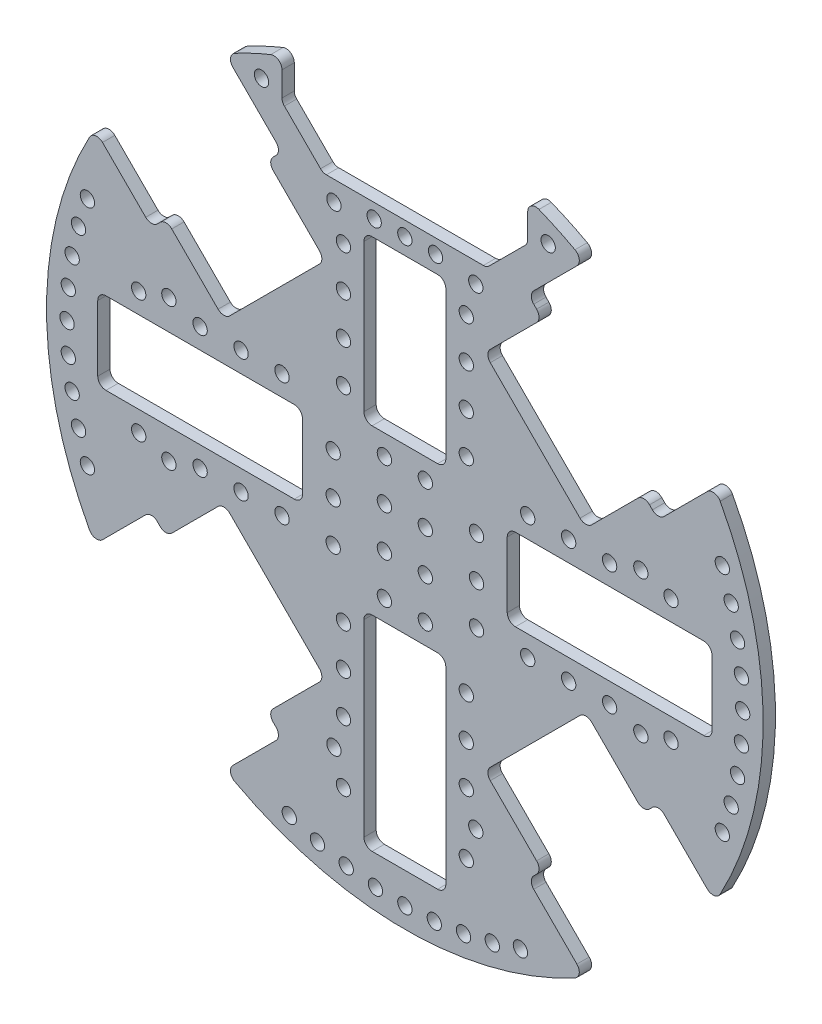
from build123d import *

# Parameters (mm, degrees)
SKETCH1_R                                  = 87.5
BOSS_EXTRUDE1_DEPTH                        = 3
CUT_EXTRUDE3_START                         = -124.780046857
CUT_EXTRUDE3_DEPTH                         = 125.780046857
SKETCH5_R                                  = 1.75
CUT_EXTRUDE4_DEPTH                         = 124.780046857
MIRROR3_START                              = -124.780046857
MIRROR3_AT_THE_SECOND_PLANE_COPY_1_DEPTH   = 125.780046857
MIRROR3_AT_THE_SECOND_PLANE_COPY_2_SKETC_R = 1.75
MIRROR3_AT_THE_SECOND_PLANE_COPY_2_DEPTH   = 124.780046857
CUT_EXTRUDE5_DEPTH                         = 124.780046857
SKETCH7_W                                  = 50
SKETCH7_H                                  = 20
SKETCH7_W_2                                = 20
SKETCH7_H_2                                = 50
SKETCH7_H_3                                = 40
CUT_EXTRUDE6_DEPTH                         = 124.780046857
FILLET1_R                                  = 2
SKETCH8_R                                  = 1.75
CUT_EXTRUDE7_DEPTH                         = 124.780046857
CIRPATTERN1_COUNT                          = 5
CIRPATTERN1_ANGLE                          = 20
CIRPATTERN1_THE_OTHER_WAY_COUNT            = 5
CIRPATTERN1_THE_OTHER_WAY_ANGLE            = 20
CIRPATTERN2_COUNT                          = 3
CIRPATTERN2_ANGLE                          = 180
CIRPATTERN2_COPY_1_SKETCH_R                = 1.75
CIRPATTERN2_COPY_1_DEPTH                   = 124.780046857
CIRPATTERN2_COPY_2_SKETCH_R                = 1.75
CIRPATTERN2_COPY_2_DEPTH                   = 124.780046857
CIRPATTERN2_COPY_3_SKETCH_R                = 1.75
CIRPATTERN2_COPY_3_DEPTH                   = 124.780046857
CIRPATTERN2_COPY_4_SKETCH_R                = 1.75
CIRPATTERN2_COPY_4_DEPTH                   = 124.780046857
CIRPATTERN2_COPY_5_SKETCH_R                = 1.75
CIRPATTERN2_COPY_5_DEPTH                   = 124.780046857
CIRPATTERN2_COPY_6_SKETCH_R                = 1.75
CIRPATTERN2_COPY_6_DEPTH                   = 124.780046857
CIRPATTERN2_COPY_7_SKETCH_R                = 1.75
CIRPATTERN2_COPY_7_DEPTH                   = 124.780046857
CIRPATTERN2_COPY_8_SKETCH_R                = 1.75
CIRPATTERN2_COPY_8_DEPTH                   = 124.780046857
CIRPATTERN2_COPY_9_SKETCH_R                = 1.75
CIRPATTERN2_COPY_9_DEPTH                   = 124.780046857
CIRPATTERN2_COPY_10_SKETCH_R               = 1.75
CIRPATTERN2_COPY_10_DEPTH                  = 124.780046857
CIRPATTERN2_COPY_11_SKETCH_R               = 1.75
CIRPATTERN2_COPY_11_DEPTH                  = 124.780046857
CIRPATTERN2_COPY_12_SKETCH_R               = 1.75
CIRPATTERN2_COPY_12_DEPTH                  = 124.780046857
CIRPATTERN2_COPY_13_SKETCH_R               = 1.75
CIRPATTERN2_COPY_13_DEPTH                  = 124.780046857
CIRPATTERN2_COPY_14_SKETCH_R               = 1.75
CIRPATTERN2_COPY_14_DEPTH                  = 124.780046857
CIRPATTERN2_COPY_15_SKETCH_R               = 1.75
CIRPATTERN2_COPY_15_DEPTH                  = 124.780046857
CIRPATTERN2_COPY_16_SKETCH_R               = 1.75
CIRPATTERN2_COPY_16_DEPTH                  = 124.780046857
SKETCH9_R                                  = 1.75
CUT_EXTRUDE8_DEPTH                         = 124.780046857
CIRPATTERN3_COUNT                          = 2
CIRPATTERN3_ANGLE                          = 90
SKETCH10_R                                 = 1.75
CUT_EXTRUDE9_DEPTH                         = 124.780046857
SKETCH11_R                                 = 1.75
CUT_EXTRUDE10_DEPTH                        = 124.780046857
SKETCH12_R                                 = 1.75
CUT_EXTRUDE11_DEPTH                        = 124.780046857
SKETCH13_R                                 = 1.75
CUT_EXTRUDE12_DEPTH                        = 124.780046857


with BuildPart() as part:
    # Sketch1 → Boss-Extrude1 (new body)
    with BuildSketch(Plane.XY):
        Circle(SKETCH1_R)
    extrude(amount=BOSS_EXTRUDE1_DEPTH)

    # Sketch4 → Cut-Extrude3 (cut)
    with BuildSketch(Plane.XY.offset(3).offset(CUT_EXTRUDE3_START)):
        Polygon((30.0520382, 61.871843354), (33.587572106, 58.336309448), (19.445436483, 44.194173824), (44.194173824, 19.445436483), (58.336309448, 33.587572106), (61.871843354, 30.0520382), (84.806371442, 52.986566289), (52.986566289, 84.806371442), align=None)
    cut_extrude3 = extrude(amount=CUT_EXTRUDE3_DEPTH, mode=Mode.SUBTRACT)

    # Sketch5 → Cut-Extrude4 (cut, through all)
    with BuildSketch(Plane(origin=(0, 0, 0), x_dir=(-1, 0, 0), z_dir=(0, 0, -1))):
        with Locations((-17.324116139, 57.629202667)):
            Circle(SKETCH5_R)
        with Locations((-57.629202667, 17.324116139)):
            Circle(SKETCH5_R)
    cut_extrude4 = extrude(amount=-CUT_EXTRUDE4_DEPTH, mode=Mode.SUBTRACT)

    # Mirror3: Cut-Extrude3, Cut-Extrude4 across plane
    add(cut_extrude3.mirror(Plane(origin=(0, 0, 0), x_dir=(0, 0, 1), z_dir=(1, 0, 0))), mode=Mode.SUBTRACT)
    add(cut_extrude4.mirror(Plane(origin=(0, 0, 0), x_dir=(0, 0, 1), z_dir=(1, 0, 0))), mode=Mode.SUBTRACT)

    # Mirror3 at the second plane: Cut-Extrude3, Cut-Extrude4 across plane
    add(cut_extrude3.mirror(Plane.ZX), mode=Mode.SUBTRACT)
    add(cut_extrude4.mirror(Plane.ZX), mode=Mode.SUBTRACT)

    # Mirror3 at the second plane copy 1 sketc → Mirror3 at the second plane copy 1 (cut)
    with BuildSketch(Plane(origin=(0, 0, 3), x_dir=(-1, 0, 0), z_dir=(0, 0, 1)).offset(MIRROR3_START)):
        Polygon((30.0520382, 61.871843354), (33.587572106, 58.336309448), (19.445436483, 44.194173824), (44.194173824, 19.445436483), (58.336309448, 33.587572106), (61.871843354, 30.0520382), (84.806371442, 52.986566289), (52.986566289, 84.806371442), align=None)
    extrude(amount=MIRROR3_AT_THE_SECOND_PLANE_COPY_1_DEPTH, mode=Mode.SUBTRACT)

    # Mirror3 at the second plane copy 2 sketc → Mirror3 at the second plane copy 2 (cut, through all)
    with BuildSketch(Plane(origin=(0, 0, 0), x_dir=(1, 0, 0), z_dir=(0, 0, -1))):
        with Locations((-17.324116139, 57.629202667)):
            Circle(MIRROR3_AT_THE_SECOND_PLANE_COPY_2_SKETC_R)
        with Locations((-57.629202667, 17.324116139)):
            Circle(MIRROR3_AT_THE_SECOND_PLANE_COPY_2_SKETC_R)
    extrude(amount=-MIRROR3_AT_THE_SECOND_PLANE_COPY_2_DEPTH, mode=Mode.SUBTRACT)

    # Sketch6 → Cut-Extrude5 (cut, through all)
    with BuildSketch(Plane(origin=(0, 0, 0), x_dir=(-1, 0, 0), z_dir=(0, 0, -1))):
        Polygon((-30, 72.5), (-20, 62.5), (20, 62.5), (30, 72.5), (30, 87.5), (-30, 87.5), align=None)
    extrude(amount=-CUT_EXTRUDE5_DEPTH, mode=Mode.SUBTRACT)

    # Sketch7 → Cut-Extrude6 (cut, through all)
    with BuildSketch(Plane(origin=(0, 0, 0), x_dir=(-1, 0, 0), z_dir=(0, 0, -1))):
        with Locations((-50, 0)):
            Rectangle(SKETCH7_W, SKETCH7_H)
        with Locations((50, 0)):
            Rectangle(SKETCH7_W, SKETCH7_H)
        with Locations((0, -50)):
            Rectangle(SKETCH7_W_2, SKETCH7_H_2)
        with Locations((0, 35)):
            Rectangle(SKETCH7_W_2, SKETCH7_H_3)
    extrude(amount=-CUT_EXTRUDE6_DEPTH, mode=Mode.SUBTRACT)

    # Fillet1
    fillet1_edges = [part.edges().sort_by_distance(p)[0] for p in [
        (-43.881401139, -75.701206292, 1.5),
        (-75.701206292, -43.881401139, 1.5),
        (-44.194173824, -19.445436483, 1.5),
        (-58.336309448, -33.587572106, 1.5),
        (-61.871843354, -30.0520382, 1.5),
        (-30.0520382, -61.871843354, 1.5),
        (-33.587572106, -58.336309448, 1.5),
        (-19.445436483, -44.194173824, 1.5),
        (61.871843354, 30.0520382, 1.5),
        (43.881401139, 75.701206292, 1.5),
        (44.194173824, 19.445436483, 1.5),
        (58.336309448, 33.587572106, 1.5),
        (75.701206292, 43.881401139, 1.5),
        (30.0520382, 61.871843354, 1.5),
        (33.587572106, 58.336309448, 1.5),
        (19.445436483, 44.194173824, 1.5),
        (-30, 82.196411114, 1.5),
        (30, 82.196411114, 1.5),
        (30, 72.5, 1.5),
        (-30, 72.5, 1.5),
        (-20, 62.5, 1.5),
        (20, 62.5, 1.5),
        (25, 10, 1.5),
        (25, -10, 1.5),
        (75, -10, 1.5),
        (75, 10, 1.5),
        (-25, -10, 1.5),
        (-25, 10, 1.5),
        (-75, 10, 1.5),
        (-75, -10, 1.5),
        (-10, -25, 1.5),
        (-10, -75, 1.5),
        (10, -75, 1.5),
        (10, -25, 1.5),
        (-10, 55, 1.5),
        (-10, 15, 1.5),
        (10, 15, 1.5),
        (10, 55, 1.5),
        (30.0520382, -61.871843354, 1.5),
        (75.701206292, -43.881401139, 1.5),
        (58.336309448, -33.587572106, 1.5),
        (44.194173824, -19.445436483, 1.5),
        (19.445436483, -44.194173824, 1.5),
        (33.587572106, -58.336309448, 1.5),
        (43.881401139, -75.701206292, 1.5),
        (61.871843354, -30.0520382, 1.5),
        (-30.0520382, 61.871843354, 1.5),
        (-75.701206292, 43.881401139, 1.5),
        (-58.336309448, 33.587572106, 1.5),
        (-44.194173824, 19.445436483, 1.5),
        (-19.445436483, 44.194173824, 1.5),
        (-33.587572106, 58.336309448, 1.5),
        (-43.881401139, 75.701206292, 1.5),
        (-61.871843354, 30.0520382, 1.5),
    ]]
    fillet(fillet1_edges, radius=FILLET1_R)

    # Sketch8 → Cut-Extrude7 (cut, through all)
    with BuildSketch(Plane(origin=(0, 0, 0), x_dir=(-1, 0, 0), z_dir=(0, 0, -1))):
        with Locations((-82.5, 0)):
            Circle(SKETCH8_R)
    cut_extrude7 = extrude(amount=-CUT_EXTRUDE7_DEPTH, mode=Mode.SUBTRACT)

    # CirPattern1: Cut-Extrude7 ×5 about axis
    cirpattern1_axis = Axis((0, 0, 0), (0, 0, 1))
    for i in range(1, CIRPATTERN1_COUNT):
        add(cut_extrude7.rotate(cirpattern1_axis, i * CIRPATTERN1_ANGLE / (CIRPATTERN1_COUNT - 1)), mode=Mode.SUBTRACT)

    # CirPattern1 the other way: Cut-Extrude7 ×5 about axis
    cirpattern1_the_other_way_axis = Axis((0, 0, 0), (0, 0, -1))
    for i in range(1, CIRPATTERN1_THE_OTHER_WAY_COUNT):
        add(cut_extrude7.rotate(cirpattern1_the_other_way_axis, i * CIRPATTERN1_THE_OTHER_WAY_ANGLE / (CIRPATTERN1_THE_OTHER_WAY_COUNT - 1)), mode=Mode.SUBTRACT)

    # CirPattern2: Cut-Extrude7 ×3 about axis
    cirpattern2_axis = Axis((0, 0, 0), (0, 0, -1))
    for i in range(1, CIRPATTERN2_COUNT):
        add(cut_extrude7.rotate(cirpattern2_axis, i * CIRPATTERN2_ANGLE / (CIRPATTERN2_COUNT - 1)), mode=Mode.SUBTRACT)

    # CirPattern2 copy 1 sketch → CirPattern2 copy 1 (cut, through all)
    with BuildSketch(Plane(origin=(0, 0, 0), x_dir=(-0.08715574274765489, 0.9961946980917459, 0), z_dir=(0, 0, -1))):
        with Locations((-82.5, 0)):
            Circle(CIRPATTERN2_COPY_1_SKETCH_R)
    extrude(amount=-CIRPATTERN2_COPY_1_DEPTH, mode=Mode.SUBTRACT)

    # CirPattern2 copy 2 sketch → CirPattern2 copy 2 (cut, through all)
    with BuildSketch(Plane(origin=(0, 0, 0), x_dir=(0.9961946980917461, 0.08715574274765142, 0), z_dir=(0, 0, -1))):
        with Locations((-82.5, 0)):
            Circle(CIRPATTERN2_COPY_2_SKETCH_R)
    extrude(amount=-CIRPATTERN2_COPY_2_DEPTH, mode=Mode.SUBTRACT)

    # CirPattern2 copy 3 sketch → CirPattern2 copy 3 (cut, through all)
    with BuildSketch(Plane(origin=(0, 0, 0), x_dir=(-0.1736481776669273, 0.9848077530122086, 0), z_dir=(0, 0, -1))):
        with Locations((-82.5, 0)):
            Circle(CIRPATTERN2_COPY_3_SKETCH_R)
    extrude(amount=-CIRPATTERN2_COPY_3_DEPTH, mode=Mode.SUBTRACT)

    # CirPattern2 copy 4 sketch → CirPattern2 copy 4 (cut, through all)
    with BuildSketch(Plane(origin=(0, 0, 0), x_dir=(0.9848077530122092, 0.17364817766692386, 0), z_dir=(0, 0, -1))):
        with Locations((-82.5, 0)):
            Circle(CIRPATTERN2_COPY_4_SKETCH_R)
    extrude(amount=-CIRPATTERN2_COPY_4_DEPTH, mode=Mode.SUBTRACT)

    # CirPattern2 copy 5 sketch → CirPattern2 copy 5 (cut, through all)
    with BuildSketch(Plane(origin=(0, 0, 0), x_dir=(-0.258819045102518, 0.965925826289069, 0), z_dir=(0, 0, -1))):
        with Locations((-82.5, 0)):
            Circle(CIRPATTERN2_COPY_5_SKETCH_R)
    extrude(amount=-CIRPATTERN2_COPY_5_DEPTH, mode=Mode.SUBTRACT)

    # CirPattern2 copy 6 sketch → CirPattern2 copy 6 (cut, through all)
    with BuildSketch(Plane(origin=(0, 0, 0), x_dir=(0.9659258262890699, 0.25881904510251463, 0), z_dir=(0, 0, -1))):
        with Locations((-82.5, 0)):
            Circle(CIRPATTERN2_COPY_6_SKETCH_R)
    extrude(amount=-CIRPATTERN2_COPY_6_DEPTH, mode=Mode.SUBTRACT)

    # CirPattern2 copy 7 sketch → CirPattern2 copy 7 (cut, through all)
    with BuildSketch(Plane(origin=(0, 0, 0), x_dir=(-0.3420201433256662, 0.9396926207859093, 0), z_dir=(0, 0, -1))):
        with Locations((-82.5, 0)):
            Circle(CIRPATTERN2_COPY_7_SKETCH_R)
    extrude(amount=-CIRPATTERN2_COPY_7_DEPTH, mode=Mode.SUBTRACT)

    # CirPattern2 copy 8 sketch → CirPattern2 copy 8 (cut, through all)
    with BuildSketch(Plane(origin=(0, 0, 0), x_dir=(0.9396926207859105, 0.34202014332566294, 0), z_dir=(0, 0, -1))):
        with Locations((-82.5, 0)):
            Circle(CIRPATTERN2_COPY_8_SKETCH_R)
    extrude(amount=-CIRPATTERN2_COPY_8_DEPTH, mode=Mode.SUBTRACT)

    # CirPattern2 copy 9 sketch → CirPattern2 copy 9 (cut, through all)
    with BuildSketch(Plane(origin=(0, 0, 0), x_dir=(0.08715574274766186, 0.9961946980917452, 0), z_dir=(0, 0, -1))):
        with Locations((-82.5, 0)):
            Circle(CIRPATTERN2_COPY_9_SKETCH_R)
    extrude(amount=-CIRPATTERN2_COPY_9_DEPTH, mode=Mode.SUBTRACT)

    # CirPattern2 copy 10 sketch → CirPattern2 copy 10 (cut, through all)
    with BuildSketch(Plane(origin=(0, 0, 0), x_dir=(0.996194698091745, -0.08715574274766533, 0), z_dir=(0, 0, -1))):
        with Locations((-82.5, 0)):
            Circle(CIRPATTERN2_COPY_10_SKETCH_R)
    extrude(amount=-CIRPATTERN2_COPY_10_DEPTH, mode=Mode.SUBTRACT)

    # CirPattern2 copy 11 sketch → CirPattern2 copy 11 (cut, through all)
    with BuildSketch(Plane(origin=(0, 0, 0), x_dir=(0.1736481776669342, 0.9848077530122075, 0), z_dir=(0, 0, -1))):
        with Locations((-82.5, 0)):
            Circle(CIRPATTERN2_COPY_11_SKETCH_R)
    extrude(amount=-CIRPATTERN2_COPY_11_DEPTH, mode=Mode.SUBTRACT)

    # CirPattern2 copy 12 sketch → CirPattern2 copy 12 (cut, through all)
    with BuildSketch(Plane(origin=(0, 0, 0), x_dir=(0.9848077530122068, -0.17364817766693763, 0), z_dir=(0, 0, -1))):
        with Locations((-82.5, 0)):
            Circle(CIRPATTERN2_COPY_12_SKETCH_R)
    extrude(amount=-CIRPATTERN2_COPY_12_DEPTH, mode=Mode.SUBTRACT)

    # CirPattern2 copy 13 sketch → CirPattern2 copy 13 (cut, through all)
    with BuildSketch(Plane(origin=(0, 0, 0), x_dir=(0.2588190451025248, 0.9659258262890672, 0), z_dir=(0, 0, -1))):
        with Locations((-82.5, 0)):
            Circle(CIRPATTERN2_COPY_13_SKETCH_R)
    extrude(amount=-CIRPATTERN2_COPY_13_DEPTH, mode=Mode.SUBTRACT)

    # CirPattern2 copy 14 sketch → CirPattern2 copy 14 (cut, through all)
    with BuildSketch(Plane(origin=(0, 0, 0), x_dir=(0.9659258262890663, -0.2588190451025282, 0), z_dir=(0, 0, -1))):
        with Locations((-82.5, 0)):
            Circle(CIRPATTERN2_COPY_14_SKETCH_R)
    extrude(amount=-CIRPATTERN2_COPY_14_DEPTH, mode=Mode.SUBTRACT)

    # CirPattern2 copy 15 sketch → CirPattern2 copy 15 (cut, through all)
    with BuildSketch(Plane(origin=(0, 0, 0), x_dir=(0.34202014332567277, 0.9396926207859069, 0), z_dir=(0, 0, -1))):
        with Locations((-82.5, 0)):
            Circle(CIRPATTERN2_COPY_15_SKETCH_R)
    extrude(amount=-CIRPATTERN2_COPY_15_DEPTH, mode=Mode.SUBTRACT)

    # CirPattern2 copy 16 sketch → CirPattern2 copy 16 (cut, through all)
    with BuildSketch(Plane(origin=(0, 0, 0), x_dir=(0.9396926207859057, -0.34202014332567604, 0), z_dir=(0, 0, -1))):
        with Locations((-82.5, 0)):
            Circle(CIRPATTERN2_COPY_16_SKETCH_R)
    extrude(amount=-CIRPATTERN2_COPY_16_DEPTH, mode=Mode.SUBTRACT)

    # Sketch9 → Cut-Extrude8 (cut, through all)
    with BuildSketch(Plane(origin=(0, 0, 0), x_dir=(-1, 0, 0), z_dir=(0, 0, -1))):
        with Locations((-50, 15)):
            Circle(SKETCH9_R)
        with Locations((50, 15)):
            Circle(SKETCH9_R)
        with Locations((50, -15)):
            Circle(SKETCH9_R)
        with Locations((-50, -15)):
            Circle(SKETCH9_R)
        with Locations((-40, 15)):
            Circle(SKETCH9_R)
        with Locations((-40, -15)):
            Circle(SKETCH9_R)
        with Locations((-30, 15)):
            Circle(SKETCH9_R)
        with Locations((-30, -15)):
            Circle(SKETCH9_R)
        with Locations((40, 15)):
            Circle(SKETCH9_R)
        with Locations((40, -15)):
            Circle(SKETCH9_R)
        with Locations((30, 15)):
            Circle(SKETCH9_R)
        with Locations((30, -15)):
            Circle(SKETCH9_R)
        with Locations((-65, 15)):
            Circle(SKETCH9_R)
        with Locations((-65, -15)):
            Circle(SKETCH9_R)
        with Locations((65, 15)):
            Circle(SKETCH9_R)
        with Locations((65, -15)):
            Circle(SKETCH9_R)
    cut_extrude8 = extrude(amount=-CUT_EXTRUDE8_DEPTH, mode=Mode.SUBTRACT)

    # CirPattern3: Cut-Extrude8 ×2 about axis
    cirpattern3_axis = Axis((0, 0, 0), (0, 0, 1))
    for i in range(1, CIRPATTERN3_COUNT):
        add(cut_extrude8.rotate(cirpattern3_axis, i * CIRPATTERN3_ANGLE / (CIRPATTERN3_COUNT - 1)), mode=Mode.SUBTRACT)

    # Sketch10 → Cut-Extrude9 (cut, through all)
    with BuildSketch(Plane(origin=(0, 0, 0), x_dir=(-1, 0, 0), z_dir=(0, 0, -1))):
        with Locations((-5, -20)):
            Circle(SKETCH10_R)
        with Locations((5, -20)):
            Circle(SKETCH10_R)
        with Locations((5, -10)):
            Circle(SKETCH10_R)
        with Locations((-5, -10)):
            Circle(SKETCH10_R)
        with Locations((5, 0)):
            Circle(SKETCH10_R)
        with Locations((-5, 0)):
            Circle(SKETCH10_R)
        with Locations((5, 10)):
            Circle(SKETCH10_R)
        with Locations((-5, 10)):
            Circle(SKETCH10_R)
    extrude(amount=-CUT_EXTRUDE9_DEPTH, mode=Mode.SUBTRACT)

    # Sketch11 → Cut-Extrude10 (cut, through all)
    with BuildSketch(Plane(origin=(0, 0, 0), x_dir=(-1, 0, 0), z_dir=(0, 0, -1))):
        with Locations((-17.5, 5)):
            Circle(SKETCH11_R)
        with Locations((17.5, 5)):
            Circle(SKETCH11_R)
        with Locations((-17.5, -5)):
            Circle(SKETCH11_R)
        with Locations((17.5, -5)):
            Circle(SKETCH11_R)
        with Locations((-17.5, -15)):
            Circle(SKETCH11_R)
        with Locations((17.5, -15)):
            Circle(SKETCH11_R)
    extrude(amount=-CUT_EXTRUDE10_DEPTH, mode=Mode.SUBTRACT)

    # Sketch12 → Cut-Extrude11 (cut, through all)
    with BuildSketch(Plane(origin=(0, 0, 0), x_dir=(-1, 0, 0), z_dir=(0, 0, -1))):
        with Locations((-15, 20)):
            Circle(SKETCH12_R)
        with Locations((15, 20)):
            Circle(SKETCH12_R)
    extrude(amount=-CUT_EXTRUDE11_DEPTH, mode=Mode.SUBTRACT)

    # Sketch13 → Cut-Extrude12 (cut, through all)
    with BuildSketch(Plane(origin=(0, 0, 0), x_dir=(-1, 0, 0), z_dir=(0, 0, -1))):
        with Locations((-35, 75)):
            Circle(SKETCH13_R)
        with Locations((35, 75)):
            Circle(SKETCH13_R)
        with Locations((0, 59)):
            Circle(SKETCH13_R)
        with Locations((7.5, 59)):
            Circle(SKETCH13_R)
        with Locations((-7.5, 59)):
            Circle(SKETCH13_R)
    extrude(amount=-CUT_EXTRUDE12_DEPTH, mode=Mode.SUBTRACT)


solid = part.part
